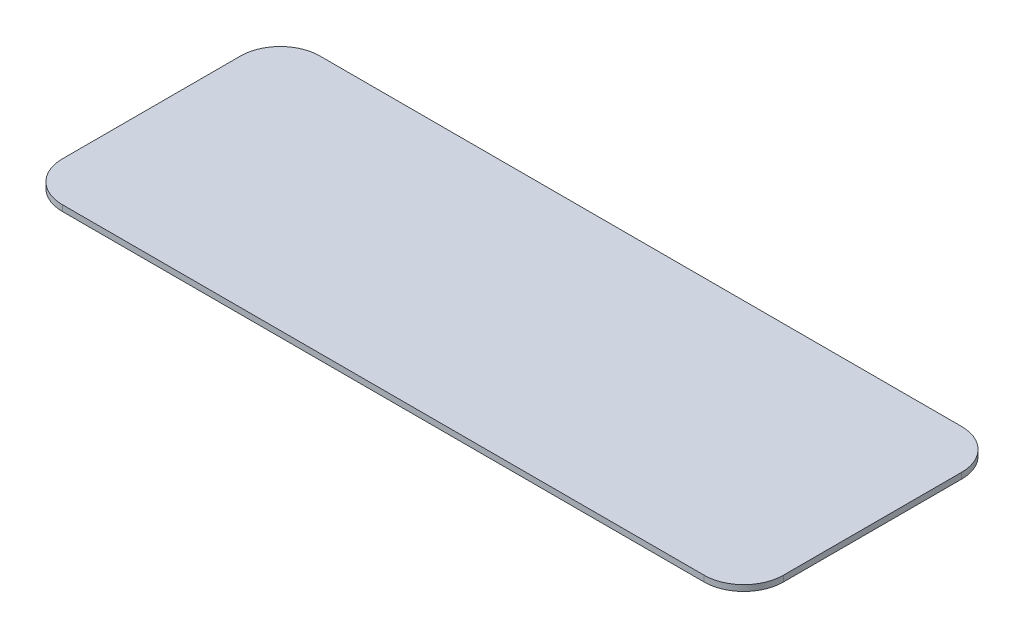
from build123d import *

# Parameters (mm, degrees)
SKETCH_1_W      = 182
SKETCH_1_H      = 65
EXTRUDE_1_DEPTH = 1.5
FILLET_1_R      = 10


with BuildPart() as part:
    # 草图1 → 凸台-拉伸1 (new body)
    with BuildSketch(Plane(origin=(0, 0, 0), x_dir=(1, 0, 0), z_dir=(0, 1, 0))):
        Rectangle(SKETCH_1_W, SKETCH_1_H)
    extrude(amount=EXTRUDE_1_DEPTH)

    # 圆角1
    fillet_1_edges = [part.edges().sort_by_distance(p)[0] for p in [
        (-91, 0.75, -32.5),
        (91, 0.75, -32.5),
        (91, 0.75, 32.5),
        (-91, 0.75, 32.5),
    ]]
    fillet(fillet_1_edges, radius=FILLET_1_R)


solid = part.part
